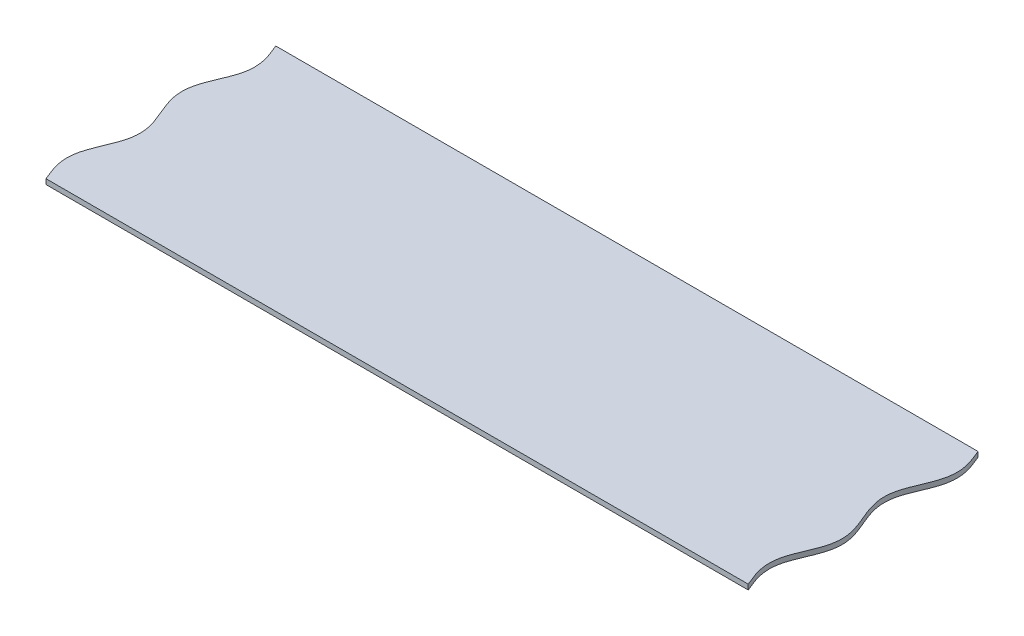
from build123d import *

# Parameters (mm, degrees)
BOSS_EXTRUDE1_DEPTH = 0.4


with BuildPart() as part:
    # Sketch1 → Boss-Extrude1 (new body)
    with BuildSketch(Plane(origin=(0, 0, 0), x_dir=(1, 0, 0), z_dir=(0, 1, 0))):
        with BuildLine():
            Line((0, 0), (55, 0))
            add(Edge.make_bspline(
                [(55, 0), (55.049449566, -0.118048236), (55.111116121, -0.265261767), (55.230875713, -0.558055111), (55.313966248, -0.78653977), (55.362563048, -0.927516596), (55.424573498, -1.120266976), (55.492346834, -1.361576076), (55.554441877, -1.649698324), (55.592274908, -1.949406714), (55.603031319, -2.206899085), (55.596617784, -2.46474337), (55.573067652, -2.7216697), (55.514178041, -3.063998966), (55.399297623, -3.48531299), (55.25089524, -3.895665746), (55.085536401, -4.299154578), (54.900409644, -4.737446397), (54.703159304, -5.220718922), (54.506351444, -5.796953023), (54.381026537, -6.483449136), (54.400372028, -7.232066465), (54.618776409, -8.120124004), (54.999944314, -9.00003028), (55.381336688, -9.879808571), (55.600500416, -10.767651071), (55.620704458, -11.51624215), (55.496048404, -12.202876161), (55.299570119, -12.779233487), (55.102439222, -13.262553413), (54.917314953, -13.700851056), (54.751862189, -14.104290103), (54.603274031, -14.51459272), (54.488062188, -14.935780978), (54.421537982, -15.320493582), (54.39512077, -15.663626876), (54.40367216, -16.00799493), (54.445977619, -16.349164286), (54.516955418, -16.677374827), (54.607052673, -16.98805117), (54.713878, -17.293418434), (54.815256707, -17.556083772), (54.925906416, -17.823098462), (54.975275264, -17.940975828), (55, -18)],
                knots=[0.08332238, 0.08332238, 0.08332238, 0.08332238, 0.08332238, 0.11060458, 0.117425131, 0.124245681, 0.131066232, 0.137886783, 0.153149398, 0.168412013, 0.183674669, 0.191305997, 0.198937325, 0.214200036, 0.229462748, 0.25292918, 0.276395612, 0.29165835, 0.306921087, 0.337446562, 0.369116698, 0.399642007, 0.430167333, 0.469468854, 0.53051982, 0.569821341, 0.600346668, 0.630871977, 0.662542111, 0.693067587, 0.708330324, 0.723593062, 0.747059493, 0.770525924, 0.785788637, 0.801051349, 0.816314005, 0.83157666, 0.846839275, 0.862101891, 0.875742992, 0.889384094, 0.903025196, 0.916666297, 0.916666297, 0.916666297, 0.916666297, 0.916666297], degree=4))
            Line((55, -18), (0, -18))
            add(Edge.make_bspline(
                [(0, 0), (0.049449566, -0.118048236), (0.111116121, -0.265261767), (0.230875713, -0.558055111), (0.313966248, -0.78653977), (0.362563048, -0.927516596), (0.424573498, -1.120266976), (0.492346834, -1.361576076), (0.554441877, -1.649698324), (0.592274908, -1.949406714), (0.603031319, -2.206899085), (0.596617784, -2.46474337), (0.573067652, -2.7216697), (0.514178041, -3.063998966), (0.399297623, -3.48531299), (0.25089524, -3.895665746), (0.085536401, -4.299154578), (-0.099590356, -4.737446397), (-0.296840696, -5.220718922), (-0.493648556, -5.796953023), (-0.618973463, -6.483449136), (-0.599627972, -7.232066465), (-0.381223591, -8.120124004), (-5.5686e-05, -9.00003028), (0.381336688, -9.879808571), (0.600500416, -10.767651071), (0.620704458, -11.51624215), (0.496048404, -12.202876161), (0.299570119, -12.779233487), (0.102439222, -13.262553413), (-0.082685047, -13.700851056), (-0.248137811, -14.104290103), (-0.396725969, -14.51459272), (-0.511937812, -14.935780978), (-0.578462018, -15.320493582), (-0.60487923, -15.663626876), (-0.59632784, -16.00799493), (-0.554022381, -16.349164286), (-0.483044582, -16.677374827), (-0.392947327, -16.98805117), (-0.286122, -17.293418434), (-0.184743293, -17.556083772), (-0.074093584, -17.823098462), (-0.024724736, -17.940975828), (0, -18)],
                knots=[0.08332238, 0.08332238, 0.08332238, 0.08332238, 0.08332238, 0.11060458, 0.117425131, 0.124245681, 0.131066232, 0.137886783, 0.153149398, 0.168412013, 0.183674669, 0.191305997, 0.198937325, 0.214200036, 0.229462748, 0.25292918, 0.276395612, 0.29165835, 0.306921087, 0.337446562, 0.369116698, 0.399642007, 0.430167333, 0.469468854, 0.53051982, 0.569821341, 0.600346668, 0.630871977, 0.662542111, 0.693067587, 0.708330324, 0.723593062, 0.747059493, 0.770525924, 0.785788637, 0.801051349, 0.816314005, 0.83157666, 0.846839275, 0.862101891, 0.875742992, 0.889384094, 0.903025196, 0.916666297, 0.916666297, 0.916666297, 0.916666297, 0.916666297], degree=4))
        make_face()
    extrude(amount=BOSS_EXTRUDE1_DEPTH)


solid = part.part
